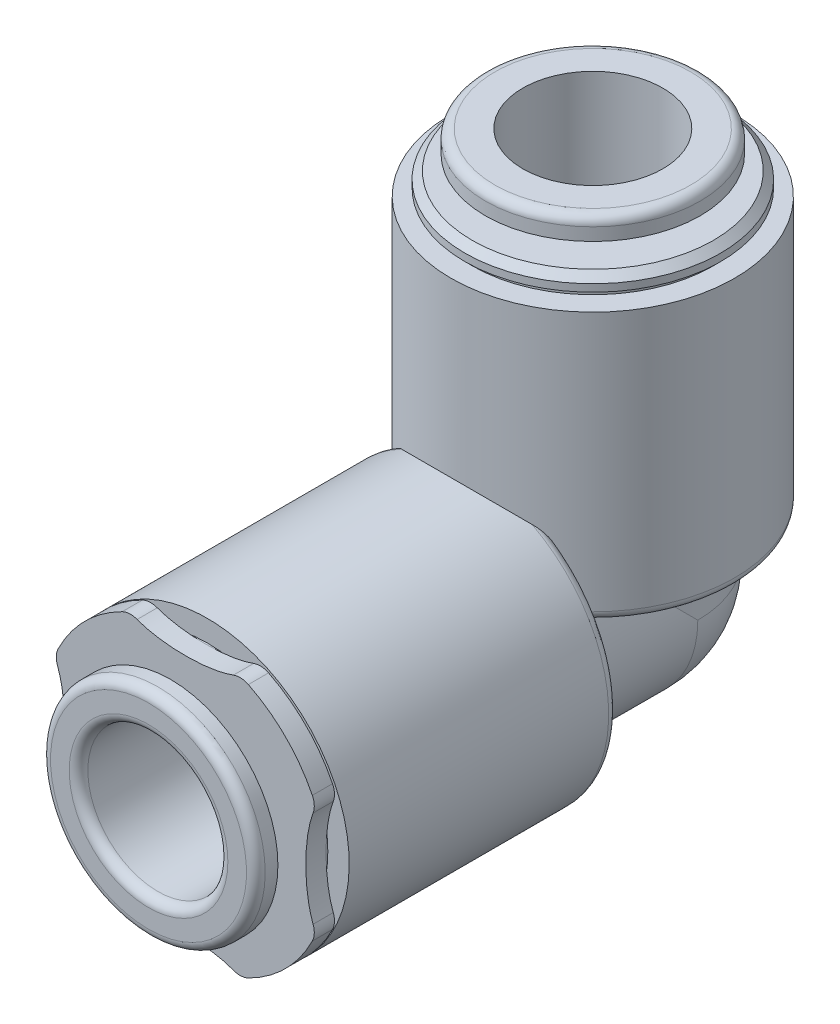
from build123d import *

# Parameters (mm, degrees)
SKETCH3_R                = 9.652
SKETCH3_R_2              = 8.1995
BOSS_EXTRUDE1_DEPTH      = 1.373
SKETCH4_RX               = 4.3575
SKETCH4_RY               = 1.4525
CUT_EXTRUDE1_DEPTH       = 1.373
FILLET1_R                = 1.27
CIRPATTERN1_COUNT        = 4
FILLET1_OF_CIRPATTERN1_R = 1.27


with BuildPart() as part:
    # Sketch1 → Revolve1 (revolve)
    with BuildSketch(Plane(origin=(0, 0, 0), x_dir=(0, 0, -1), z_dir=(1, 0, 0)), mode=Mode.PRIVATE) as revolve1_sk:
        with BuildLine():
            Line((-30.226, 0), (7.14375, 0))
            ThreePointArc((7.14375, 0), (5.051394068, 5.051394068), (0, 7.14375))
            Line((0, 7.14375), (-7.3025, 7.14375))
            ThreePointArc((-7.3025, 7.14375), (-7.751512806, 7.329737194), (-7.9375, 7.77875))
            Line((-7.9375, 7.77875), (-7.9375, 9.017))
            ThreePointArc((-7.9375, 9.017), (-8.123487194, 9.466012806), (-8.5725, 9.652))
            Line((-8.5725, 9.652), (-26.226, 9.652))
            Line((-26.226, 9.652), (-26.226, 8.1995))
            Line((-26.226, 8.1995), (-26.726, 8.1995))
            Line((-26.726, 8.1995), (-26.726, 8.6995))
            Line((-26.726, 8.6995), (-27.226, 8.6995))
            Line((-27.226, 8.6995), (-27.726, 8.1995))
            Line((-27.726, 8.1995), (-27.726, 5.3975))
            Line((-27.726, 5.3975), (-28.726, 5.3975))
            Line((-28.726, 5.3975), (-28.726, 7.3025))
            Line((-28.726, 7.3025), (-29.591, 7.3025))
            ThreePointArc((-29.591, 7.3025), (-30.040012806, 7.116512806), (-30.226, 6.6675))
            Line((-30.226, 6.6675), (-30.226, 0))
        make_face()
    revolve(revolve1_sk.sketch.rotate(Axis((0, 0, 30.226), (0, 0, -1)), 180), axis=Axis((0, 0, 30.226), (0, 0, -1)))

    # Sketch5 → Revolve2 (revolve)
    with BuildSketch(Plane(origin=(0, 0, 0), x_dir=(0, 0, -1), z_dir=(1, 0, 0)), mode=Mode.PRIVATE) as revolve2_sk:
        with BuildLine():
            Line((0, -7.14375), (0, 25.4))
            Line((0, 25.4), (6.6675, 25.4))
            ThreePointArc((6.6675, 25.4), (7.116512806, 25.214012806), (7.3025, 24.765))
            Line((7.3025, 24.765), (7.3025, 23.9))
            Line((7.3025, 23.9), (5.3975, 23.9))
            Line((5.3975, 23.9), (5.3975, 22.9))
            Line((5.3975, 22.9), (8.199501, 22.9))
            Line((8.199501, 22.9), (8.6995, 22.400001))
            Line((8.6995, 22.400001), (8.6995, 21.900002))
            Line((8.6995, 21.900002), (8.199501, 21.900002))
            Line((8.199501, 21.900002), (8.199501, 21.400003))
            Line((8.199501, 21.400003), (9.652, 21.400003))
            Line((9.652, 21.400003), (9.652, 3.7465))
            ThreePointArc((9.652, 3.7465), (9.466012806, 3.297487194), (9.017, 3.1115))
            Line((9.017, 3.1115), (7.77875, 3.1115))
            ThreePointArc((7.77875, 3.1115), (7.329737194, 2.925512806), (7.14375, 2.4765))
            Line((7.14375, 2.4765), (7.14375, 0))
            ThreePointArc((7.14375, 0), (5.051394068, -5.051394068), (0, -7.14375))
        make_face()
    revolve(revolve2_sk.sketch.rotate(Axis((0, 0, 0), (0, -1, 0)), 180), axis=Axis((0, 0, 0), (0, -1, 0)))

    # Sketch2 → Cut-Revolve1 (revolve, cut)
    with BuildSketch(Plane(origin=(0, 0, 0), x_dir=(0, 0, -1), z_dir=(1, 0, 0)), mode=Mode.PRIVATE) as cut_revolve1_sk:
        with BuildLine():
            Line((-30.226, 4.7625), (-30.226, 0))
            Line((-30.226, 0), (3.81, 0))
            ThreePointArc((3.81, 0), (2.694076836, 2.694076836), (0, 3.81))
            Line((0, 3.81), (-10.414, 3.81))
            Line((-10.414, 3.81), (-10.414, 4.7625))
            Line((-10.414, 4.7625), (-29.591, 4.7625))
            ThreePointArc((-29.591, 4.7625), (-30.040012806, 4.948487194), (-30.226, 5.3975))
            Line((-30.226, 5.3975), (-30.226, 4.7625))
        make_face()
    revolve(cut_revolve1_sk.sketch.rotate(Axis((0, 0, 30.226), (0, 0, -1)), 90), axis=Axis((0, 0, 30.226), (0, 0, -1)), mode=Mode.SUBTRACT)

    # Sketch6 → Cut-Revolve2 (revolve, cut)
    with BuildSketch(Plane(origin=(0, 0, 0), x_dir=(0, 0, -1), z_dir=(1, 0, 0)), mode=Mode.PRIVATE) as cut_revolve2_sk:
        with BuildLine():
            Line((4.7625, 25.4), (0, 25.4))
            Line((0, 25.4), (0, -3.81))
            ThreePointArc((0, -3.81), (2.694076836, -2.694076836), (3.81, 0))
            Line((3.81, 0), (3.81, 5.588))
            Line((3.81, 5.588), (4.7625, 5.588))
            Line((4.7625, 5.588), (4.7625, 25.4))
        make_face()
    revolve(cut_revolve2_sk.sketch.rotate(Axis((0, 25.4, 0), (0, -1, 0)), 180), axis=Axis((0, 25.4, 0), (0, -1, 0)), mode=Mode.SUBTRACT)

    # Sketch3 → Boss-Extrude1 (add)
    with BuildSketch(Plane.XY.offset(27.726)):
        with Locations(Location((0, 0, 0), (0, 0, 270))):
            Circle(SKETCH3_R)
        with Locations(Location((0, 0, 0), (0, 0, 270))):
            Circle(SKETCH3_R_2, mode=Mode.SUBTRACT)
    extrude(amount=-BOSS_EXTRUDE1_DEPTH)

    # Sketch4 → Cut-Extrude1 (cut)
    with BuildSketch(Plane.XY.offset(27.726)):
        with Locations((0, 9.652)):
            Ellipse(SKETCH4_RX, SKETCH4_RY)
    cut_extrude1 = extrude(amount=-CUT_EXTRUDE1_DEPTH, mode=Mode.SUBTRACT)

    # Fillet1
    fillet1_edges = [part.edges().sort_by_distance(p)[0] for p in [
        (3.731095913, 8.901686766, 27.0395),
        (-3.731095913, 8.901686766, 27.0395),
    ]]
    fillet(fillet1_edges, radius=FILLET1_R)

    # CirPattern1: Cut-Extrude1 ×4 about axis
    cirpattern1_axis = Axis((0, 0, -1.073978608), (0, 0, 1))
    for i in range(1, CIRPATTERN1_COUNT):
        add(cut_extrude1.rotate(cirpattern1_axis, i * 360 / CIRPATTERN1_COUNT), mode=Mode.SUBTRACT)

    # Fillet1 of CirPattern1
    fillet1_of_cirpattern1_edges = [part.edges().sort_by_distance(p)[0] for p in [
        (-8.901686766, 3.731095913, 27.0395),
        (-8.901686766, -3.731095913, 27.0395),
        (-3.731095913, -8.901686766, 27.0395),
        (3.731095913, -8.901686766, 27.0395),
        (8.901686766, -3.731095913, 27.0395),
        (8.901686766, 3.731095913, 27.0395),
    ]]
    fillet(fillet1_of_cirpattern1_edges, radius=FILLET1_OF_CIRPATTERN1_R)


solid = part.part
